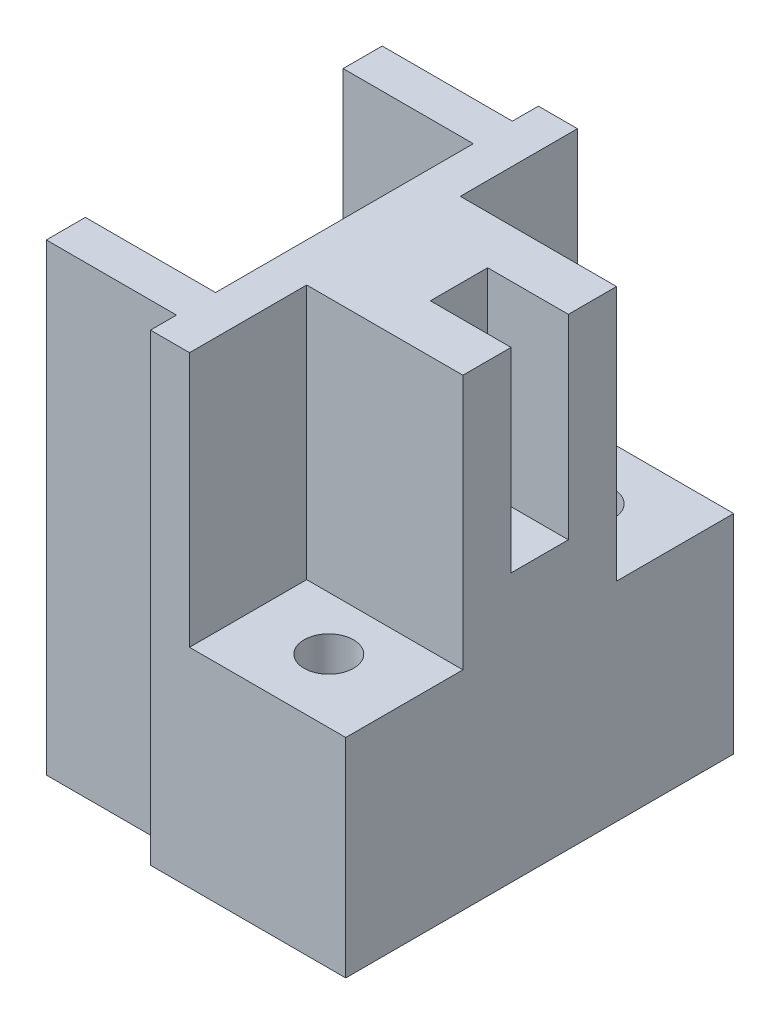
from build123d import *

# Parameters (mm, degrees)
SKETCH1_R           = 2.413
BOSS_EXTRUDE1_DEPTH = 45.212
SKETCH1_4_W         = 7.874
SKETCH1_4_H         = 5.588
BOSS_EXTRUDE2_DEPTH = 26.162
CUT_EXTRUDE1_START  = -24.892
SKETCH2_W           = 15.24
SKETCH2_H           = 11.43
SKETCH2_R           = 2.413
CUT_EXTRUDE1_DEPTH  = 24.892


with BuildPart() as part:
    # Sketch1 → Boss-Extrude1 (new body)
    with BuildSketch(Plane(origin=(0, 0, 0), x_dir=(1, 0, 0), z_dir=(0, 1, 0))):
        Polygon((40.25170153, 21.085507102), (40.25170153, 37.214507102), (21.20170153, 37.214507102), (21.20170153, 34.674507102), (8.50170153, 34.674507102), (8.50170153, 30.864507102), (21.20170153, 30.864507102), (21.20170153, 5.718507102), (8.50170153, 5.718507102), (8.50170153, 1.908507102), (21.20170153, 1.908507102), (21.20170153, -0.631492898), (40.25170153, -0.631492898), (40.25170153, 15.497507102), (32.37770153, 15.497507102), (32.37770153, 21.085507102), align=None)
        with Locations((32.37770153, 30.991507102)):
            Circle(SKETCH1_R, mode=Mode.SUBTRACT)
        with Locations((32.37770153, 5.591507102)):
            Circle(SKETCH1_R, mode=Mode.SUBTRACT)
    extrude(amount=BOSS_EXTRUDE1_DEPTH)

    # Sketch1<4> → Boss-Extrude2 (add)
    with BuildSketch(Plane(origin=(0, 0, 0), x_dir=(1, 0, 0), z_dir=(0, 1, 0))):
        with Locations((36.31470153, 18.291507102)):
            Rectangle(SKETCH1_4_W, SKETCH1_4_H)
    extrude(amount=BOSS_EXTRUDE2_DEPTH)

    # Sketch2 → Cut-Extrude1 (cut)
    # profile 1 of 2: a face of its own
    with BuildSketch(Plane(origin=(0, 45.212, 0), x_dir=(1, 0, 0), z_dir=(0, 1, 0)).offset(CUT_EXTRUDE1_START)):
        with Locations((32.63170153, 31.499507102)):
            Rectangle(SKETCH2_W, SKETCH2_H)
        with Locations((32.37770153, 30.991507102)):
            Circle(SKETCH2_R, mode=Mode.SUBTRACT)
    # profile 2 of 2: a face of its own
    with BuildSketch(Plane(origin=(0, 45.212, 0), x_dir=(1, 0, 0), z_dir=(0, 1, 0)).offset(CUT_EXTRUDE1_START)):
        with Locations((32.63170153, 5.083507102)):
            Rectangle(SKETCH2_W, SKETCH2_H)
        with Locations((32.37770153, 5.591507102)):
            Circle(SKETCH2_R, mode=Mode.SUBTRACT)
    extrude(amount=CUT_EXTRUDE1_DEPTH, mode=Mode.SUBTRACT)


solid = part.part
